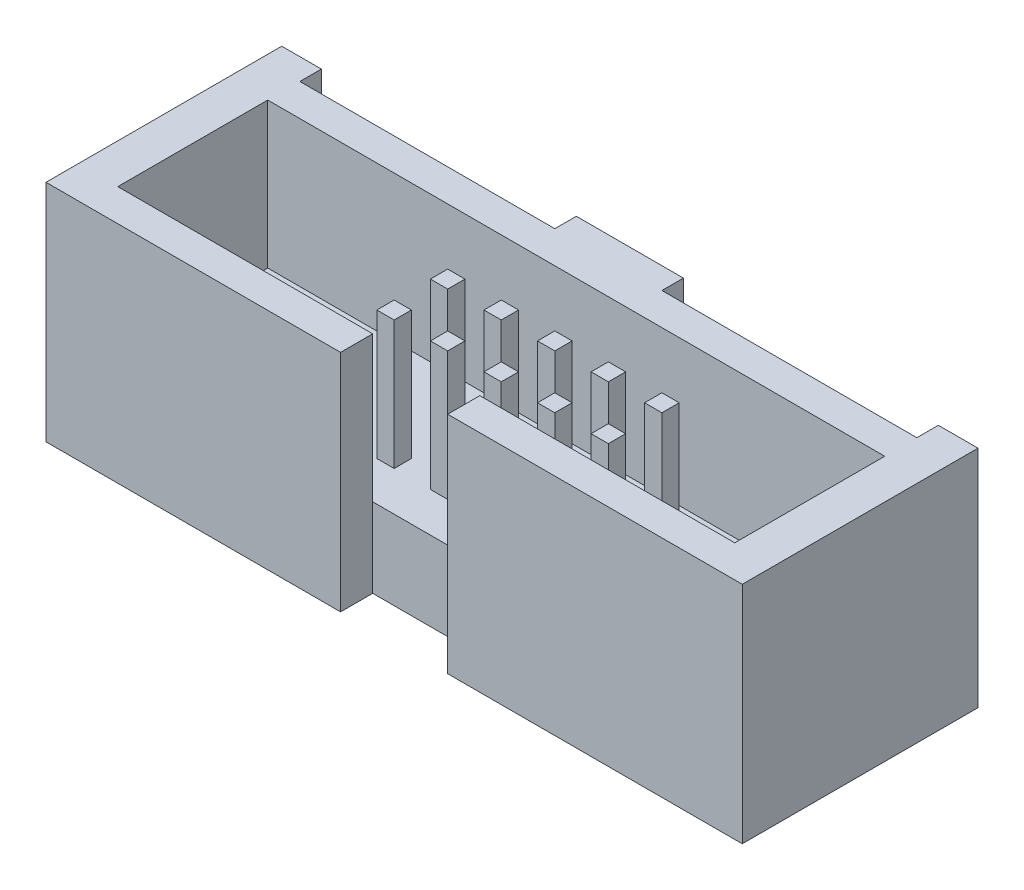
from build123d import *

# Parameters (mm, degrees)
SKETCH1_W               = 16.51
SKETCH1_H               = 5.08
BOSS_EXTRUDE1_DEPTH     = 5.33
SKETCH2_W               = 14.63
SKETCH2_H               = 3.556
CUT_EXTRUDE1_DEPTH      = 3.45
SKETCH4_W               = 0.94
SKETCH4_H               = 5.33
SKETCH4_W_2             = 1.27
BOSS_EXTRUDE2_DEPTH     = 0.51
SKETCH5_W               = 1.27
SKETCH5_H               = 5.33
CUT_EXTRUDE2_DEPTH      = 0.762
SKETCH6_W               = 0.41
SKETCH6_H               = 0.41
BOSS_EXTRUDE3_DEPTH     = 3.05
LPATTERN1_COUNT         = 3
LPATTERN1_PITCH         = 1.27
LPATTERN1_COL_COUNT     = 3
LPATTERN1_COL_PITCH     = 1.27
MIRROR2_COPY_1_SKETCH_W = 0.41
MIRROR2_COPY_1_SKETCH_H = 0.41
MIRROR2_COPY_1_DEPTH    = 3.05
MIRROR2_COPY_2_SKETCH_W = 0.41
MIRROR2_COPY_2_SKETCH_H = 0.41
MIRROR2_COPY_2_DEPTH    = 3.05
MIRROR2_COPY_3_SKETCH_W = 0.41
MIRROR2_COPY_3_SKETCH_H = 0.41
MIRROR2_COPY_3_DEPTH    = 3.05
MIRROR2_COPY_4_SKETCH_W = 0.41
MIRROR2_COPY_4_SKETCH_H = 0.41
MIRROR2_COPY_4_DEPTH    = 3.05


with BuildPart() as part:
    # Sketch1 → Boss-Extrude1 (new body)
    with BuildSketch(Plane(origin=(0, 0, 0), x_dir=(1, 0, 0), z_dir=(0, 1, 0))):
        Rectangle(SKETCH1_W, SKETCH1_H)
    extrude(amount=BOSS_EXTRUDE1_DEPTH)

    # Sketch2 → Cut-Extrude1 (cut)
    with BuildSketch(Plane(origin=(0, 5.33, 0), x_dir=(1, 0, 0), z_dir=(0, 1, 0))):
        Rectangle(SKETCH2_W, SKETCH2_H)
    cut_extrude1 = extrude(amount=-CUT_EXTRUDE1_DEPTH, mode=Mode.SUBTRACT)

    # Sketch4 → Boss-Extrude2 (add)
    with BuildSketch(Plane(origin=(0, 0, -2.54), x_dir=(-1, 0, 0), z_dir=(0, 0, -1))):
        with Locations((-7.785, 2.665)):
            Rectangle(SKETCH4_W, SKETCH4_H)
        with Locations((-0.635, 2.665)):
            Rectangle(SKETCH4_W_2, SKETCH4_H)
    boss_extrude2 = extrude(amount=BOSS_EXTRUDE2_DEPTH)

    # Sketch5 → Cut-Extrude2 (cut)
    with BuildSketch(Plane.XY.offset(2.54)):
        with Locations((0.635, 2.665)):
            Rectangle(SKETCH5_W, SKETCH5_H)
    cut_extrude2 = extrude(amount=-CUT_EXTRUDE2_DEPTH, mode=Mode.SUBTRACT)

    # Mirror1: Cut-Extrude1, Boss-Extrude2, Cut-Extrude2 across plane
    add(cut_extrude1.mirror(Plane(origin=(0, 0, 0), x_dir=(0, 0, 1), z_dir=(1, 0, 0))), mode=Mode.SUBTRACT)
    add(boss_extrude2.mirror(Plane(origin=(0, 0, 0), x_dir=(0, 0, 1), z_dir=(1, 0, 0))))
    add(cut_extrude2.mirror(Plane(origin=(0, 0, 0), x_dir=(0, 0, 1), z_dir=(1, 0, 0))), mode=Mode.SUBTRACT)

    # Sketch6 → Boss-Extrude3 (add)
    with BuildSketch(Plane(origin=(0, 1.88, 0), x_dir=(1, 0, 0), z_dir=(0, 1, 0))):
        with Locations((0.635, -0.635)):
            Rectangle(SKETCH6_W, SKETCH6_H)
    boss_extrude3 = extrude(amount=BOSS_EXTRUDE3_DEPTH)

    # LPattern1: Boss-Extrude3 ×3
    with Locations(*[(i * LPATTERN1_PITCH, 0, 0) for i in range(1, LPATTERN1_COUNT)]):
        add(boss_extrude3)

    # LPattern1 col: Boss-Extrude3 ×3
    with Locations(*[(-i * LPATTERN1_COL_PITCH, 0, 0) for i in range(1, LPATTERN1_COL_COUNT)]):
        add(boss_extrude3)

    # Mirror2: Boss-Extrude3 across plane
    add(boss_extrude3.mirror(Plane.XY))

    # Mirror2 copy 1 sketch → Mirror2 copy 1 (add)
    with BuildSketch(Plane(origin=(1.27, 1.88, 0), x_dir=(1, 0, 0), z_dir=(0, 1, 0))):
        with Locations((0.635, 0.635)):
            Rectangle(MIRROR2_COPY_1_SKETCH_W, MIRROR2_COPY_1_SKETCH_H)
    extrude(amount=MIRROR2_COPY_1_DEPTH)

    # Mirror2 copy 2 sketch → Mirror2 copy 2 (add)
    with BuildSketch(Plane(origin=(2.54, 1.88, 0), x_dir=(1, 0, 0), z_dir=(0, 1, 0))):
        with Locations((0.635, 0.635)):
            Rectangle(MIRROR2_COPY_2_SKETCH_W, MIRROR2_COPY_2_SKETCH_H)
    extrude(amount=MIRROR2_COPY_2_DEPTH)

    # Mirror2 copy 3 sketch → Mirror2 copy 3 (add)
    with BuildSketch(Plane(origin=(-1.27, 1.88, 0), x_dir=(1, 0, 0), z_dir=(0, 1, 0))):
        with Locations((0.635, 0.635)):
            Rectangle(MIRROR2_COPY_3_SKETCH_W, MIRROR2_COPY_3_SKETCH_H)
    extrude(amount=MIRROR2_COPY_3_DEPTH)

    # Mirror2 copy 4 sketch → Mirror2 copy 4 (add)
    with BuildSketch(Plane(origin=(-2.54, 1.88, 0), x_dir=(1, 0, 0), z_dir=(0, 1, 0))):
        with Locations((0.635, 0.635)):
            Rectangle(MIRROR2_COPY_4_SKETCH_W, MIRROR2_COPY_4_SKETCH_H)
    extrude(amount=MIRROR2_COPY_4_DEPTH)


solid = part.part
